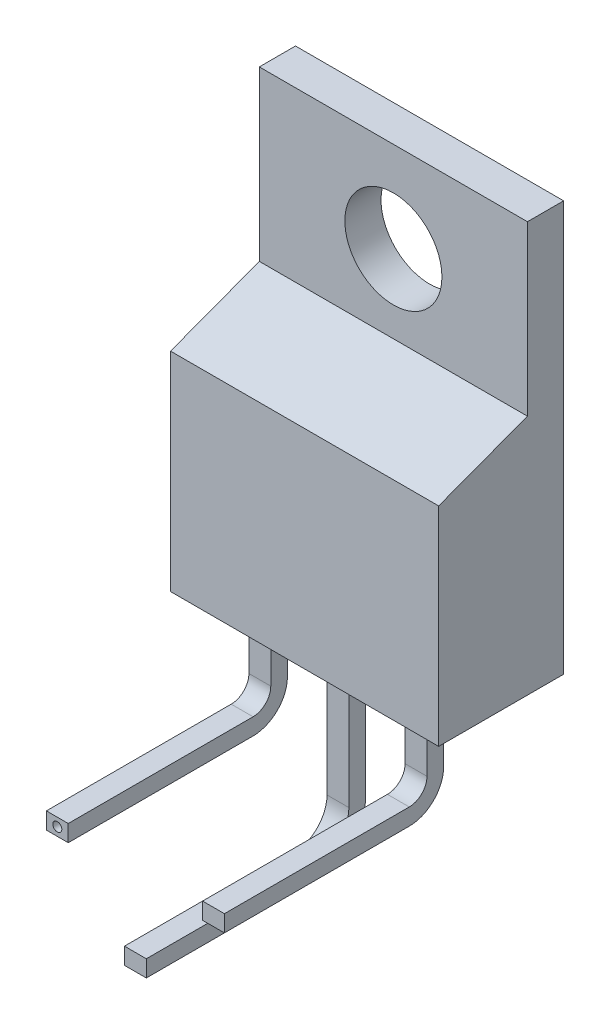
from build123d import *

# Parameters (mm, degrees)
SKETCH_5_W                      = 10.3
SKETCH_5_H                      = 4.8
EXTRUDE_1_DEPTH                 = 15.75
CUT_EXTRUDE_1_REACH             = 23.278
CUT_EXTRUDE_1_DIRECTION_2_REACH = 23.278
SKETCH_11_R                     = 1.865
CUT_EXTRUDE_2_DEPTH             = 4.8
SKETCH_3_W                      = 0.84
SKETCH_3_H                      = 0.64
SKETCH_4_W                      = 0.84
SKETCH_4_H                      = 0.64
SKETCH_3_3_W                    = 0.84
SKETCH_3_3_H                    = 0.64
EXTRUDE_2_DEPTH                 = 2.5
SKETCH_4_3_W                    = 0.84
SKETCH_4_3_H                    = 0.64
EXTRUDE_3_DEPTH                 = 2.5
SKETCH_12_W                     = 0.84
SKETCH_12_H                     = 0.64
EXTRUDE_4_DEPTH                 = 4
EXTRUDE_5_DEPTH                 = 0.46
EXTRUDE_6_DEPTH                 = 0.46
CUT_EXTRUDE_3_DEPTH             = 0.46
CUT_EXTRUDE_START               = -0.46
CUT_EXTRUDE_4_DEPTH             = 0.46
SKETCH_17_R                     = 0.172950306
CUT_EXTRUDE_5_DEPTH             = 2
SKETCH_18_W                     = 11.930877945
SKETCH_18_H                     = 3.370946467
CUT_EXTRUDE_6_DEPTH             = 2
EXTRUDE_7_DEPTH                 = 0.84


with BuildPart() as part:
    # Эскиз5 → Вытянуть1 (new body)
    with BuildSketch(Plane(origin=(0, 3.5, 0), x_dir=(-1, 0, 0), z_dir=(0, 1, 0))):
        with Locations((-2.54, -2.4)):
            Rectangle(SKETCH_5_W, SKETCH_5_H)
    extrude(amount=EXTRUDE_1_DEPTH)

    # Вырез-Вытянуть1: up to this face of the body (flat: up to its plane)
    cut_extrude_1_end = Plane(part.part.faces().sort_by_distance((-2.61, 11.375, -2.4))[0])
    # Эскиз10 → Вырез-Вытянуть1 (cut, up to the picked face)
    with BuildSketch(Plane(origin=(0, 0, 0), x_dir=(0, 0, -1), z_dir=(1, 0, 0)), mode=Mode.PRIVATE) as cut_extrude_1_sk1:
        Polygon((0, 19.25), (3.41, 19.25), (3.41, 12.78), (0, 11.5), align=None)
    cut_extrude_1_tool1 = split(extrude(cut_extrude_1_sk1.sketch, amount=-CUT_EXTRUDE_1_REACH, mode=Mode.PRIVATE), bisect_by=cut_extrude_1_end, keep=Keep.BOTH, mode=Mode.PRIVATE)
    add(cut_extrude_1_tool1.solids().sort_by(Axis((0, 15.685398, -1.653842), (-1, 0, 0)))[0], mode=Mode.SUBTRACT)

    # Вырез-Вытянуть1 direction 2: up to this face of the body (flat: up to its plane)
    cut_extrude_1_direction_2_end = Plane(part.part.faces().sort_by_distance((7.69, 11.375, -2.4))[0])
    # Эскиз10 → Вырез-Вытянуть1 direction 2 (cut, up to the picked face)
    with BuildSketch(Plane(origin=(0, 0, 0), x_dir=(0, 0, -1), z_dir=(1, 0, 0)), mode=Mode.PRIVATE) as cut_extrude_1_direction_2_sk1:
        Polygon((0, 19.25), (3.41, 19.25), (3.41, 12.78), (0, 11.5), align=None)
    cut_extrude_1_direction_2_tool1 = split(extrude(cut_extrude_1_direction_2_sk1.sketch, amount=CUT_EXTRUDE_1_DIRECTION_2_REACH, mode=Mode.PRIVATE), bisect_by=cut_extrude_1_direction_2_end, keep=Keep.BOTH, mode=Mode.PRIVATE)
    add(cut_extrude_1_direction_2_tool1.solids().sort_by(Axis((0, 15.685398, -1.653842), (1, 0, 0)))[0], mode=Mode.SUBTRACT)

    # Эскиз11 → Вырез-Вытянуть2 (cut)
    with BuildSketch(Plane.XY):
        with Locations((2.54, 15.77)):
            Circle(SKETCH_11_R)
    extrude(amount=-CUT_EXTRUDE_2_DEPTH, mode=Mode.SUBTRACT)

    # По траектории1: sweep along a path in Эскиз8
    with BuildLine(Plane(origin=(0, 0, 0), x_dir=(0, 0, -1), z_dir=(1, 0, 0))) as sweep_1_path:
        Line((0, 0), (0.6, 0))
        ThreePointArc((0.6, 0), (1.307106781, 0.292893219), (1.6, 1))
        Line((1.6, 1), (1.6, 3.5))
    # Эскиз3 → По траектории1 (sweep)
    with BuildSketch(Plane.XY):
        Rectangle(SKETCH_3_W, SKETCH_3_H)
        with Locations((5.08, 0)):
            Rectangle(SKETCH_3_W, SKETCH_3_H)
    sweep(path=sweep_1_path.line)

    # По траектории2: sweep along a path in Эскиз9
    with BuildLine(Plane(origin=(0, 0, 0), x_dir=(0, 0, -1), z_dir=(1, 0, 0))) as sweep_2_path:
        Line((0, -2.54), (0.6, -2.54))
        ThreePointArc((0.6, -2.54), (1.307106781, -2.247106781), (1.6, -1.54))
        Line((1.6, -1.54), (1.6, 4.77))
    # Эскиз4 → По траектории2 (sweep)
    with BuildSketch(Plane.XY):
        with Locations((2.54, -2.54)):
            Rectangle(SKETCH_4_W, SKETCH_4_H)
    sweep(path=sweep_2_path.line)

    # Эскиз3<3> → Вытянуть2 (add)
    with BuildSketch(Plane.XY):
        Rectangle(SKETCH_3_3_W, SKETCH_3_3_H)
        with Locations((5.08, 0)):
            Rectangle(SKETCH_3_3_W, SKETCH_3_3_H)
    extrude(amount=EXTRUDE_2_DEPTH)

    # Эскиз4<3> → Вытянуть3 (add)
    with BuildSketch(Plane.XY):
        with Locations((2.54, -2.54)):
            Rectangle(SKETCH_4_3_W, SKETCH_4_3_H)
    extrude(amount=EXTRUDE_3_DEPTH)

    # Эскиз12 → Вытянуть4 (add)
    with BuildSketch(Plane.XY.offset(2.5)):
        Rectangle(SKETCH_12_W, SKETCH_12_H)
        with Locations((5.08, 0)):
            Rectangle(SKETCH_12_W, SKETCH_12_H)
        with Locations((2.54, -2.54)):
            Rectangle(SKETCH_12_W, SKETCH_12_H)
    extrude(amount=EXTRUDE_4_DEPTH)

    # Эскиз13 → Вытянуть5 (add)
    with BuildSketch(Plane.ZY.offset(0.42)):
        with BuildLine():
            Line((-0.6, -0.32), (6.5, -0.32))
            Line((6.5, -0.32), (6.5, 0.32))
            Line((6.5, 0.32), (-0.6, 0.32))
            ThreePointArc((-0.6, 0.32), (-1.080832611, 0.519167389), (-1.28, 1))
            Line((-1.28, 1), (-1.28, 3.5))
            Line((-1.28, 3.5), (-1.92, 3.5))
            Line((-1.92, 3.5), (-1.92, 1))
            ThreePointArc((-1.92, 1), (-1.533380951, 0.066619049), (-0.6, -0.32))
        make_face()
    extrude(amount=EXTRUDE_5_DEPTH)

    # Эскиз14 → Вытянуть6 (add)
    with BuildSketch(Plane(origin=(5.5, 0, 0), x_dir=(0, 0, -1), z_dir=(1, 0, 0))):
        with BuildLine():
            Line((0.6, 0.32), (-6.5, 0.32))
            Line((-6.5, 0.32), (-6.5, -0.32))
            Line((-6.5, -0.32), (0.6, -0.32))
            ThreePointArc((0.6, -0.32), (1.533380951, 0.066619049), (1.92, 1))
            Line((1.92, 1), (1.92, 3.5))
            Line((1.92, 3.5), (1.28, 3.5))
            Line((1.28, 3.5), (1.28, 1))
            ThreePointArc((1.28, 1), (1.080832611, 0.519167389), (0.6, 0.32))
        make_face()
    extrude(amount=EXTRUDE_6_DEPTH)

    # Эскиз15 → Вырез-Вытянуть3 (cut)
    with BuildSketch(Plane.ZY.offset(-4.66)):
        with BuildLine():
            Line((-0.6, -0.32), (6.5, -0.32))
            Line((6.5, -0.32), (6.5, 0.32))
            Line((6.5, 0.32), (-0.6, 0.32))
            ThreePointArc((-0.6, 0.32), (-1.080832611, 0.519167389), (-1.28, 1))
            Line((-1.28, 1), (-1.28, 3.5))
            Line((-1.28, 3.5), (-1.92, 3.5))
            Line((-1.92, 3.5), (-1.92, 1))
            ThreePointArc((-1.92, 1), (-1.533380951, 0.066619049), (-0.6, -0.32))
        make_face()
    extrude(amount=-CUT_EXTRUDE_3_DEPTH, mode=Mode.SUBTRACT)

    # Эскиз16 → Вырез-Вытянуть4 (cut)
    with BuildSketch(Plane(origin=(0.42, 0, 0), x_dir=(0, 0, -1), z_dir=(1, 0, 0)).offset(CUT_EXTRUDE_START)):
        with BuildLine():
            Line((0.6, 0.32), (-6.5, 0.32))
            Line((-6.5, 0.32), (-6.5, -0.32))
            Line((-6.5, -0.32), (0.6, -0.32))
            ThreePointArc((0.6, -0.32), (1.533380951, 0.066619049), (1.92, 1))
            Line((1.92, 1), (1.92, 3.5))
            Line((1.92, 3.5), (1.28, 3.5))
            Line((1.28, 3.5), (1.28, 1))
            ThreePointArc((1.28, 1), (1.080832611, 0.519167389), (0.6, 0.32))
        make_face()
    extrude(amount=CUT_EXTRUDE_4_DEPTH, mode=Mode.SUBTRACT)

    # Эскиз17 → Вырез-Вытянуть5 (cut)
    with BuildSketch(Plane.XY.offset(6.5)):
        with Locations((-0.46, 0)):
            Circle(SKETCH_17_R)
    extrude(amount=-CUT_EXTRUDE_5_DEPTH, mode=Mode.SUBTRACT)

    # Эскиз18 → Вырез-Вытянуть6 (cut)
    with BuildSketch(Plane.ZY.offset(-2.12)):
        with Locations((2.005211992, -3.225473234)):
            Rectangle(SKETCH_18_W, SKETCH_18_H)
    extrude(amount=-CUT_EXTRUDE_6_DEPTH, mode=Mode.SUBTRACT)

    # Эскиз19 → Вытянуть7 (add)
    with BuildSketch(Plane.ZY.offset(-2.12)):
        with BuildLine():
            Line((-0.6, -3.32), (6.5, -3.32))
            Line((6.5, -3.32), (6.5, -2.68))
            Line((6.5, -2.68), (-0.6, -2.68))
            ThreePointArc((-0.6, -2.68), (-1.097088212, -2.20370174), (-1.28, -1.54))
            Line((-1.28, -1.54), (-1.92, -1.54))
            ThreePointArc((-1.92, -1.54), (-1.553991604, -2.648016245), (-0.6, -3.32))
        make_face()
    extrude(amount=-EXTRUDE_7_DEPTH)


solid = part.part
